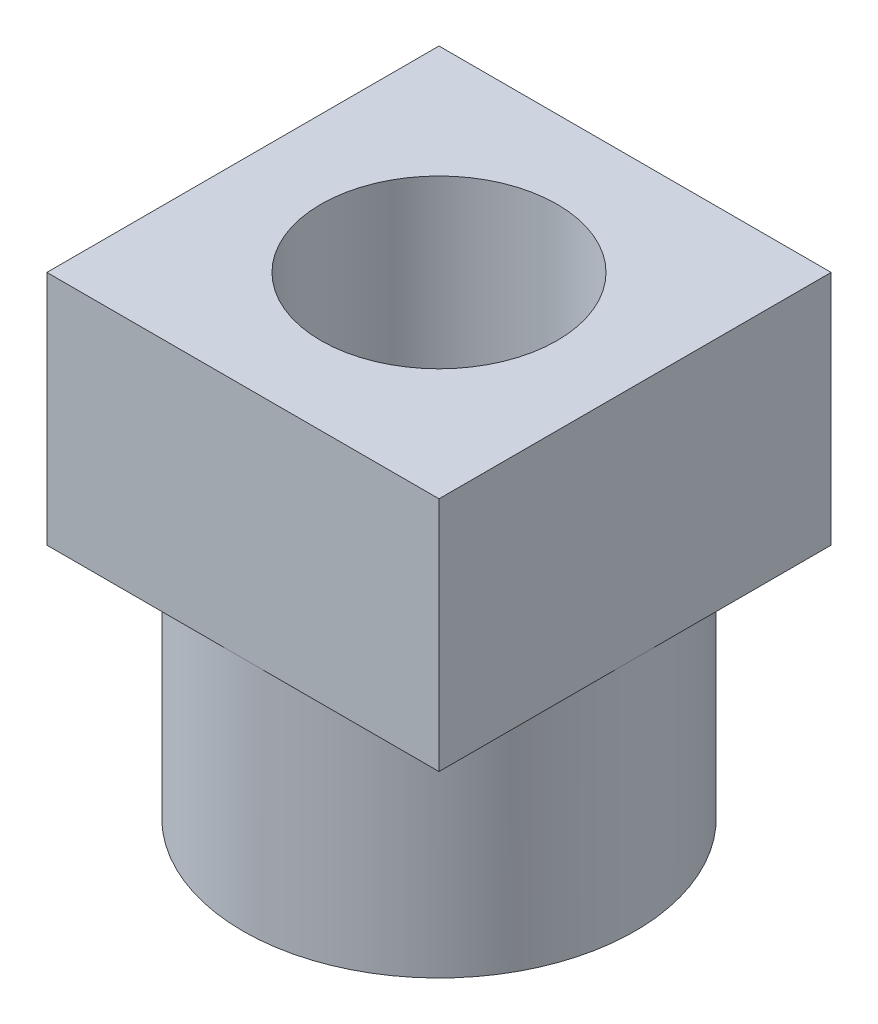
from build123d import *

# Parameters (mm, degrees)
SKETCH1_W           = 16.6
SKETCH1_H           = 16.6
BOSS_EXTRUDE1_DEPTH = 10
SKETCH3_R           = 5
CUT_EXTRUDE1_DEPTH  = 10
SKETCH4_R           = 8.3
SKETCH4_R_2         = 2.5
BOSS_EXTRUDE2_DEPTH = 10


with BuildPart() as part:
    # Sketch1 → Boss-Extrude1 (new body)
    with BuildSketch(Plane(origin=(0, 0, 0), x_dir=(1, 0, 0), z_dir=(0, 1, 0))):
        Rectangle(SKETCH1_W, SKETCH1_H)
    extrude(amount=BOSS_EXTRUDE1_DEPTH)

    # Sketch3 → Cut-Extrude1 (cut)
    with BuildSketch(Plane.XZ):
        with Locations(Location((0, 0, 0), (0, 0, 270))):
            Circle(SKETCH3_R)
    extrude(amount=-CUT_EXTRUDE1_DEPTH, mode=Mode.SUBTRACT)

    # Sketch4 → Boss-Extrude2 (add)
    with BuildSketch(Plane.XZ):
        with Locations(Location((0, 0, 0), (0, 0, 270))):
            Circle(SKETCH4_R)
        with Locations(Location((0, 0, 0), (0, 0, 270))):
            Circle(SKETCH4_R_2, mode=Mode.SUBTRACT)
    extrude(amount=BOSS_EXTRUDE2_DEPTH)


solid = part.part
